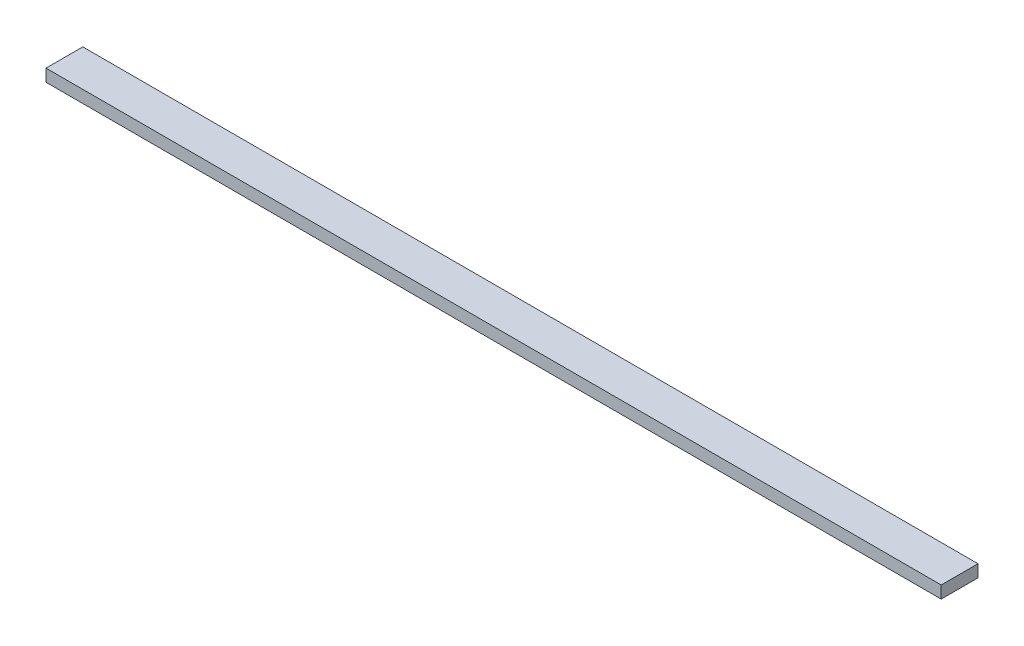
from build123d import *

# Parameters (mm, degrees)
SKETCH1_W           = 927.1
SKETCH1_H           = 38.1
BOSS_EXTRUDE1_DEPTH = 12.7


with BuildPart() as part:
    # Sketch1 → Boss-Extrude1 (new body)
    with BuildSketch(Plane(origin=(0, 0, 0), x_dir=(1, 0, 0), z_dir=(0, 1, 0))):
        with Locations((463.55, 19.05)):
            Rectangle(SKETCH1_W, SKETCH1_H)
    extrude(amount=BOSS_EXTRUDE1_DEPTH)


solid = part.part
